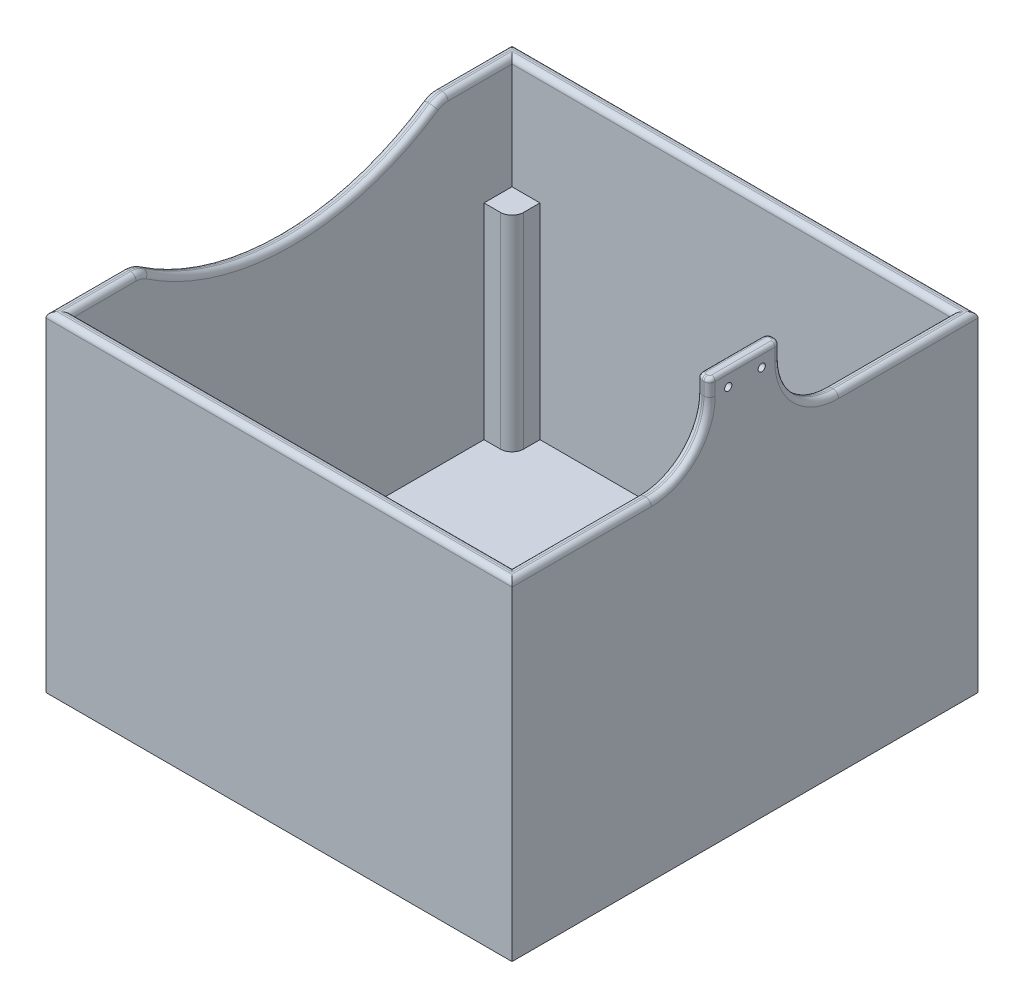
from build123d import *

# Parameters (mm, degrees)
SKETCH1_W           = 200
SKETCH1_H           = 200
BOSS_EXTRUDE1_DEPTH = 5.6
SKETCH2_W           = 200
SKETCH2_H           = 200
SKETCH2_W_2         = 188.8
SKETCH2_H_2         = 188.8
BOSS_EXTRUDE2_DEPTH = 136
SKETCH3_W           = 5.6
SKETCH3_H           = 30.4
BOSS_EXTRUDE3_DEPTH = 32
FILLET1_R           = 25
SKETCH4_R           = 110
CUT_EXTRUDE1_DEPTH  = 12
FILLET3_R           = 10
FILLET2_R           = 2.4
SKETCH5_W           = 12
SKETCH5_H           = 12
BOSS_EXTRUDE4_DEPTH = 88
FILLET4_R           = 5
SKETCH6_R           = 1.55
CUT_EXTRUDE2_DEPTH  = 332.868889774
FILLET5_R           = 1.6


with BuildPart() as part:
    # Sketch1 → Boss-Extrude1 (new body)
    with BuildSketch(Plane(origin=(0, 0, 0), x_dir=(1, 0, 0), z_dir=(0, 1, 0))):
        with Locations((100, -100)):
            Rectangle(SKETCH1_W, SKETCH1_H)
    extrude(amount=BOSS_EXTRUDE1_DEPTH)

    # Sketch2 → Boss-Extrude2 (add)
    with BuildSketch(Plane(origin=(0, 5.6, 0), x_dir=(1, 0, 0), z_dir=(0, 1, 0))):
        with Locations((100, -100)):
            Rectangle(SKETCH2_W, SKETCH2_H)
        with Locations((100, -100)):
            Rectangle(SKETCH2_W_2, SKETCH2_H_2, mode=Mode.SUBTRACT)
    extrude(amount=BOSS_EXTRUDE2_DEPTH)

    # Sketch3 → Boss-Extrude3 (add)
    with BuildSketch(Plane(origin=(0, 141.6, 0), x_dir=(1, 0, 0), z_dir=(0, 1, 0))):
        with Locations((197.2, -100)):
            Rectangle(SKETCH3_W, SKETCH3_H)
    extrude(amount=BOSS_EXTRUDE3_DEPTH)

    # Fillet1
    fillet1_edges = [part.edges().sort_by_distance(p)[0] for p in [
        (197.2, 141.6, 115.2),
        (197.2, 141.6, 84.8),
    ]]
    fillet(fillet1_edges, radius=FILLET1_R)

    # Sketch4 → Cut-Extrude1 (cut)
    with BuildSketch(Plane.ZY):
        with Locations((100, 231.210075879)):
            Circle(SKETCH4_R)
    extrude(amount=-CUT_EXTRUDE1_DEPTH, mode=Mode.SUBTRACT)

    # Fillet3
    fillet3_edges = [part.edges().sort_by_distance(p)[0] for p in [
        (2.8, 141.6, 163.796820462),
        (2.8, 141.6, 36.203179538),
    ]]
    fillet(fillet3_edges, radius=FILLET3_R)

    # Fillet2
    fillet2_edges = [part.edges().sort_by_distance(p)[0] for p in [
        (0, 141.6, 16.541694665),
        (100, 141.6, 200),
        (200, 141.6, 170.1),
        (100, 141.6, 0),
        (100, 141.6, 194.4),
        (194.4, 141.6, 167.3),
        (100, 141.6, 5.6),
        (5.6, 141.6, 19.341694665),
        (194.4, 170.1, 84.8),
        (194.4, 170.1, 115.2),
        (200, 170.1, 115.2),
        (200, 170.1, 84.8),
        (200, 141.6, 29.9),
        (194.4, 141.6, 32.7),
        (200, 148.92233047, 122.52233047),
        (194.4, 148.92233047, 122.52233047),
        (194.4, 148.92233047, 77.47766953),
        (200, 148.92233047, 77.47766953),
        (5.6, 141.6, 180.658305335),
        (0, 141.6, 183.458305335),
        (0, 121.210075879, 100),
        (0, 141.16578268, 35.99814519),
        (0, 141.16578268, 164.00185481),
        (5.6, 121.210075879, 100),
        (5.6, 141.16578268, 35.99814519),
        (5.6, 141.16578268, 164.00185481),
    ]]
    fillet(fillet2_edges, radius=FILLET2_R)

    # Sketch5 → Boss-Extrude4 (add)
    with BuildSketch(Plane(origin=(0, 5.6, 0), x_dir=(1, 0, 0), z_dir=(0, 1, 0))):
        with Locations((188.4, -11.6)):
            Rectangle(SKETCH5_W, SKETCH5_H)
        with Locations((188.4, -188.4)):
            Rectangle(SKETCH5_W, SKETCH5_H)
        with Locations((11.6, -11.6)):
            Rectangle(SKETCH5_W, SKETCH5_H)
        with Locations((11.6, -188.4)):
            Rectangle(SKETCH5_W, SKETCH5_H)
    extrude(amount=BOSS_EXTRUDE4_DEPTH)

    # Fillet4
    fillet4_edges = [part.edges().sort_by_distance(p)[0] for p in [
        (182.4, 49.6, 17.6),
        (182.4, 49.6, 182.4),
        (17.6, 49.6, 17.6),
        (17.6, 49.6, 182.4),
    ]]
    fillet(fillet4_edges, radius=FILLET4_R)

    # Sketch6 → Cut-Extrude2 (cut, through all)
    with BuildSketch(Plane(origin=(200, 0, 0), x_dir=(0, 0, -1), z_dir=(1, 0, 0))):
        with Locations((-107.2, 167.2)):
            Circle(SKETCH6_R)
        with Locations((-92.8, 167.2)):
            Circle(SKETCH6_R)
    extrude(amount=-CUT_EXTRUDE2_DEPTH, mode=Mode.SUBTRACT)

    # Fillet5
    fillet5_edges = [part.edges().sort_by_distance(p)[0] for p in [
        (197.2, 173.6, 115.2),
        (194.4, 173.6, 100),
        (200, 173.6, 100),
        (197.2, 173.6, 84.8),
        (195.102943725, 173.6, 85.502943725),
        (199.297056275, 173.6, 85.502943725),
        (199.297056275, 173.6, 114.497056275),
        (195.102943725, 173.6, 114.497056275),
    ]]
    fillet(fillet5_edges, radius=FILLET5_R)


solid = part.part
